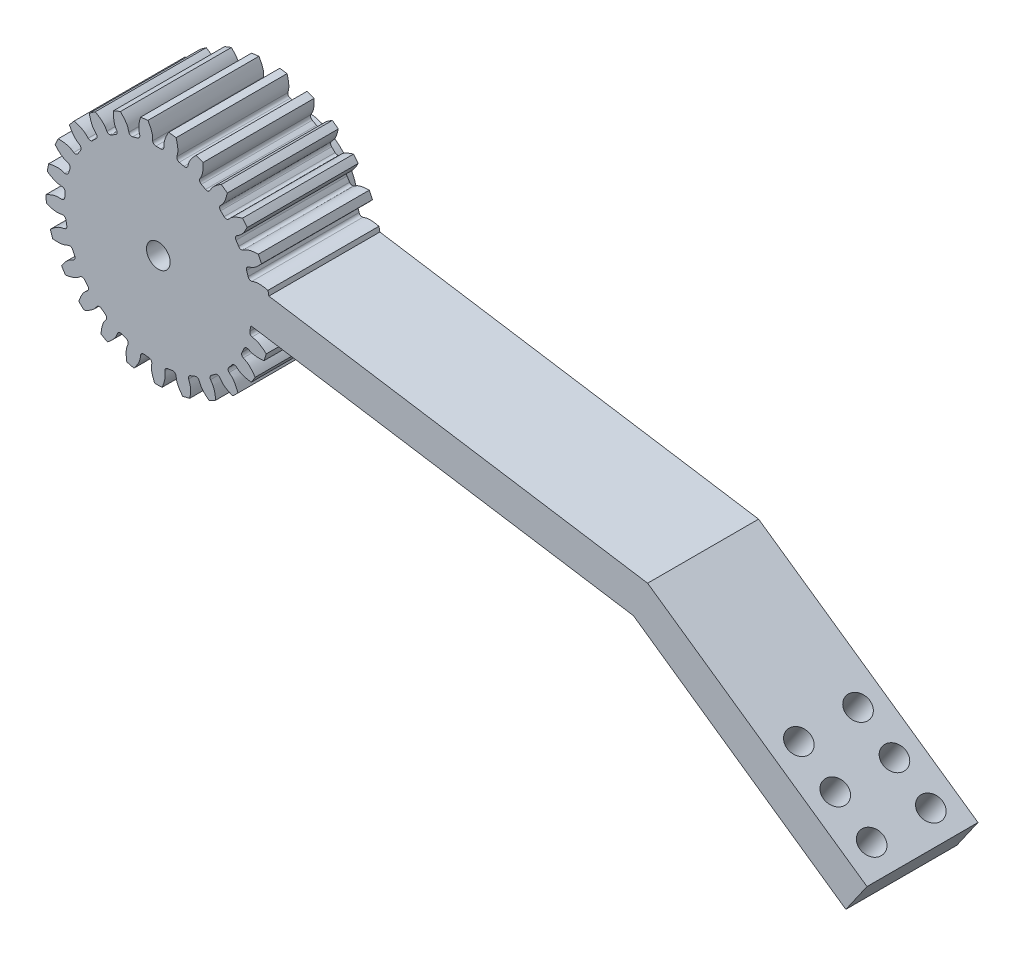
from build123d import *

# Parameters (mm, degrees)
SKETCH_1_R          = 15.1875
LASHENA_DEPTH       = 15
CUT_EXTRUDEA_DEPTH  = 15
WWW_KYTOOL_CN_COUNT = 25
SKETCH_2_R          = 1.6
CUT_EXTRUDE_1_DEPTH = 27.193824405
SKETCH_3_R          = 7.5
SKETCH_3_R_2        = 1.6
EXTRUDE_1_DEPTH     = 4.5
EXTRUDE_3_DEPTH     = 15
SKETCH_6_R          = 1.6
CUT_EXTRUDE_2_DEPTH = 24
SKETCH_7_R          = 1.6
CUT_EXTRUDE_3_DEPTH = 16


with BuildPart() as part:
    # 草图1 → LaShenA (new body)
    with BuildSketch(Plane.XY):
        Circle(SKETCH_1_R)
    extrude(amount=LASHENA_DEPTH)

    # SketchA → Cut-ExtrudeA (cut)
    with BuildSketch(Plane.XY.offset(15)):
        with BuildLine():
            ThreePointArc((0.324443957, 12.652090743), (0, 12.65625), (-0.324443957, 12.652090743))
            ThreePointArc((-0.324443957, 12.652090743), (-0.622114469, 12.762349707), (-0.76170327, 13.047445726))
            add(Edge.make_bspline(
                [(-0.76170327, 13.047445726), (-0.775328228, 13.228930177), (-0.759394526, 13.44165743), (-0.788755156, 13.664934603), (-0.799675486, 13.722720233), (-0.809304298, 13.768536103), (-0.821659042, 13.821123901), (-0.837010482, 13.880389795), (-0.855686072, 13.946216468), (-0.877989942, 14.018479865), (-0.904228386, 14.097043919), (-0.93470134, 14.181762379), (-0.969704609, 14.272478415), (-1.009528763, 14.369024922), (-1.054459055, 14.471224618), (-1.104775036, 14.578890226), (-1.160750274, 14.691824636), (-1.222652034, 14.809821084), (-1.290740991, 14.932663338), (-1.365270926, 15.060125898), (-1.446488467, 15.191974195), (-1.534632695, 15.327964812), (-1.66440648, 15.518440882), (-1.768856304, 15.660717762), (-1.842005537, 15.755887549)],
                knots=[0.123705737, 0.123705737, 0.123705737, 0.123705737, 0.284026838, 0.310496331, 0.322146932, 0.335915822, 0.351803004, 0.369808477, 0.38993224, 0.412174294, 0.436534639, 0.463013274, 0.491610201, 0.522325418, 0.555158926, 0.590110724, 0.627180814, 0.666369194, 0.707675866, 0.751100828, 0.796644081, 0.844305624, 0.894085459, 1, 1, 1, 1], degree=3))
            ThreePointArc((-1.842005537, 15.755887549), (0, 15.86319567), (1.842005537, 15.755887549))
            add(Edge.make_bspline(
                [(0.76170327, 13.047445726), (0.775328228, 13.228930177), (0.759394526, 13.44165743), (0.788755156, 13.664934603), (0.799675486, 13.722720233), (0.809304298, 13.768536103), (0.821659042, 13.821123901), (0.837010482, 13.880389795), (0.855686072, 13.946216468), (0.877989942, 14.018479865), (0.904228386, 14.097043919), (0.93470134, 14.181762379), (0.969704609, 14.272478415), (1.009528763, 14.369024922), (1.054459055, 14.471224618), (1.104775036, 14.578890226), (1.160750274, 14.691824636), (1.222652034, 14.809821084), (1.290740991, 14.932663338), (1.365270926, 15.060125898), (1.446488467, 15.191974195), (1.534632695, 15.327964812), (1.66440648, 15.518440882), (1.768856304, 15.660717762), (1.842005537, 15.755887549)],
                knots=[0.123705737, 0.123705737, 0.123705737, 0.123705737, 0.284026838, 0.310496331, 0.322146932, 0.335915822, 0.351803004, 0.369808477, 0.38993224, 0.412174294, 0.436534639, 0.463013274, 0.491610201, 0.522325418, 0.555158926, 0.590110724, 0.627180814, 0.666369194, 0.707675866, 0.751100828, 0.796644081, 0.844305624, 0.894085459, 1, 1, 1, 1], degree=3))
            ThreePointArc((0.76170327, 13.047445726), (0.622114469, 12.762349707), (0.324443957, 12.652090743))
        make_face()
    cut_extrudea = extrude(amount=-CUT_EXTRUDEA_DEPTH, mode=Mode.SUBTRACT)

    # www.KYTool.cn: Cut-ExtrudeA ×25 about axis
    www_kytool_cn_axis = Axis((0, 0, -88.99), (0, 0, 1))
    for i in range(1, WWW_KYTOOL_CN_COUNT):
        add(cut_extrudea.rotate(www_kytool_cn_axis, i * 360 / WWW_KYTOOL_CN_COUNT), mode=Mode.SUBTRACT)

    # 草图2 → 切除-拉伸1 (cut, through all)
    with BuildSketch(Plane.XY.offset(15)):
        Circle(SKETCH_2_R)
    extrude(amount=-CUT_EXTRUDE_1_DEPTH, mode=Mode.SUBTRACT)

    # 草图3 → 凸台-拉伸1 (add)
    with BuildSketch(Plane(origin=(0, 0, 0), x_dir=(-1, 0, 0), z_dir=(0, 0, -1))):
        with Locations(Location((0, 0, 0), (0, 0, 180))):
            Circle(SKETCH_3_R)
        with Locations(Location((0, 0, 0), (0, 0, 180))):
            Circle(SKETCH_3_R_2, mode=Mode.SUBTRACT)
    extrude(amount=EXTRUDE_1_DEPTH)

    # 草图5 → 凸台-拉伸3 (add)
    with BuildSketch(Plane.XY.offset(15)):
        with BuildLine():
            Line((1.481976091, -0.231833703), (64.218963939, -10.046127144))
            Line((64.218963939, -10.046127144), (92.927412493, -30.066741062))
            Line((92.927412493, -30.066741062), (95.787500195, -25.965534126))
            Line((95.787500195, -25.965534126), (66.132213415, -5.284616934))
            Line((66.132213415, -5.284616934), (0.772779011, 4.939920303))
            Line((0.772779011, 4.939920303), (0.231833703, 1.481976091))
            ThreePointArc((0.231833703, 1.481976091), (1.211846527, 0.88398416), (1.481976091, -0.231833703))
        make_face()
    extrude(amount=-EXTRUDE_3_DEPTH)

    # 草图6 → 切除-拉伸2 (cut)
    with BuildSketch(Plane.XY.offset(15)):
        Circle(SKETCH_6_R)
    extrude(amount=-CUT_EXTRUDE_2_DEPTH, mode=Mode.SUBTRACT)

    # 草图7 → 切除-拉伸3 (cut)
    with BuildSketch(Plane(origin=(19.159226742, 27.473267178, 0), x_dir=(0.8202413872444274, -0.572017540510199, 0), z_dir=(0.572017540510199, 0.8202413872444274, 0))):
        with Locations(Location((89.921613009, -11.5, 0), (0, 0, 180))):
            Circle(SKETCH_7_R)
        with Locations((89.921613009, -3.5)):
            Circle(SKETCH_7_R)
        with Locations(Location((83.921613009, -11.5, 0), (0, 0, 180))):
            Circle(SKETCH_7_R)
        with Locations((83.921613009, -3.5)):
            Circle(SKETCH_7_R)
        with Locations(Location((77.921613009, -11.5, 0), (0, 0, 180))):
            Circle(SKETCH_7_R)
        with Locations((77.921613009, -3.5)):
            Circle(SKETCH_7_R)
    extrude(amount=-CUT_EXTRUDE_3_DEPTH, mode=Mode.SUBTRACT)


solid = part.part
